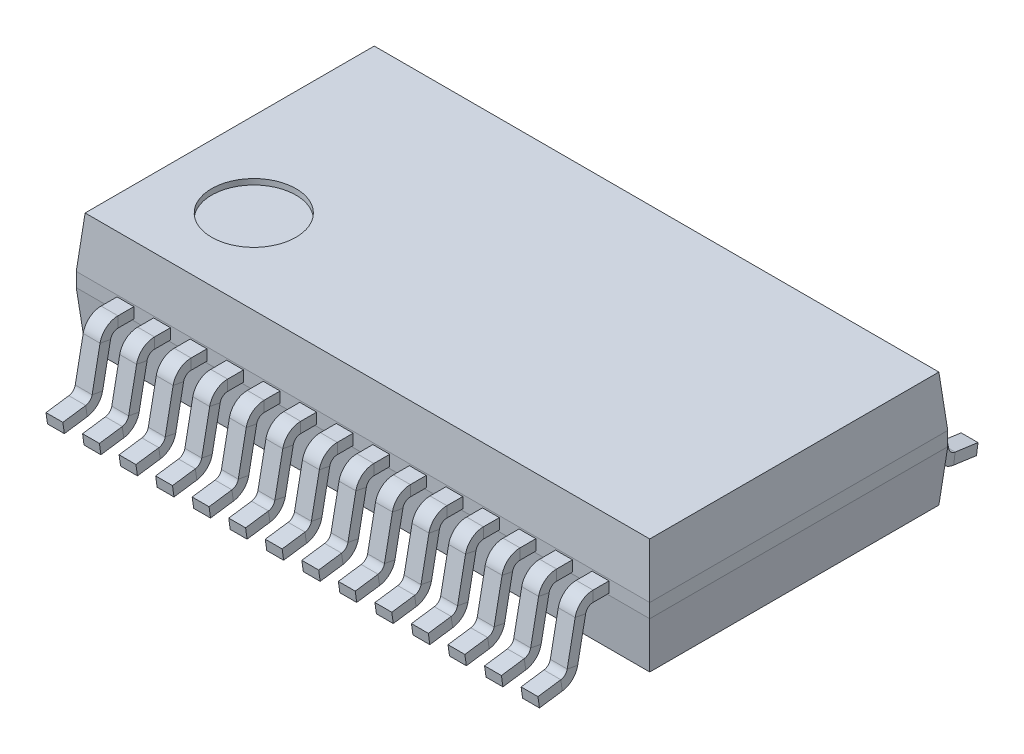
from build123d import *

# Parameters (mm, degrees)
SKETCH1_W                = 10.2
SKETCH1_H                = 5.3
BOSS_EXTRUDE1_DEPTH      = 0.25
SKETCH2_W                = 10.2
SKETCH2_H                = 5.3
BOSS_EXTRUDE2_DEPTH      = 0.9
BOSS_EXTRUDE2_TAPER      = 5
SKETCH3_W                = 10.2
SKETCH3_H                = 5.3
BOSS_EXTRUDE3_DEPTH      = 0.9
BOSS_EXTRUDE3_TAPER      = 5
SKETCH4_W                = 0.3
SKETCH4_H                = 0.19
LPATTERN1_COUNT          = 14
LPATTERN1_PITCH          = 0.65
MIRROR1_COPY_1_SKETCH_W  = 0.3
MIRROR1_COPY_1_SKETCH_H  = 0.19
MIRROR1_COPY_2_SKETCH_W  = 0.3
MIRROR1_COPY_2_SKETCH_H  = 0.19
MIRROR1_COPY_3_SKETCH_W  = 0.3
MIRROR1_COPY_3_SKETCH_H  = 0.19
MIRROR1_COPY_4_SKETCH_W  = 0.3
MIRROR1_COPY_4_SKETCH_H  = 0.19
MIRROR1_COPY_5_SKETCH_W  = 0.3
MIRROR1_COPY_5_SKETCH_H  = 0.19
MIRROR1_COPY_6_SKETCH_W  = 0.3
MIRROR1_COPY_6_SKETCH_H  = 0.19
MIRROR1_COPY_7_SKETCH_W  = 0.3
MIRROR1_COPY_7_SKETCH_H  = 0.19
MIRROR1_COPY_8_SKETCH_W  = 0.3
MIRROR1_COPY_8_SKETCH_H  = 0.19
MIRROR1_COPY_9_SKETCH_W  = 0.3
MIRROR1_COPY_9_SKETCH_H  = 0.19
MIRROR1_COPY_10_SKETCH_W = 0.3
MIRROR1_COPY_10_SKETCH_H = 0.19
MIRROR1_COPY_11_SKETCH_W = 0.3
MIRROR1_COPY_11_SKETCH_H = 0.19
MIRROR1_COPY_12_SKETCH_W = 0.3
MIRROR1_COPY_12_SKETCH_H = 0.19
MIRROR1_COPY_13_SKETCH_W = 0.3
MIRROR1_COPY_13_SKETCH_H = 0.19
SKETCH6_R                = 0.75
CUT_EXTRUDE1_DEPTH       = 0.1


with BuildPart() as part:
    # Sketch1 → Boss-Extrude1 (new body)
    with BuildSketch(Plane(origin=(0, 0, 0), x_dir=(1, 0, 0), z_dir=(0, 1, 0))):
        with Locations((5.1, 2.65)):
            Rectangle(SKETCH1_W, SKETCH1_H)
    extrude(amount=BOSS_EXTRUDE1_DEPTH)

    # Sketch2 → Boss-Extrude2 (add)
    with BuildSketch(Plane(origin=(0, 0.25, 0), x_dir=(1, 0, 0), z_dir=(0, 1, 0))):
        with Locations((5.1, 2.65)):
            Rectangle(SKETCH2_W, SKETCH2_H)
    extrude(amount=BOSS_EXTRUDE2_DEPTH, taper=BOSS_EXTRUDE2_TAPER)

    # Sketch3 → Boss-Extrude3 (add)
    with BuildSketch(Plane.XZ):
        with Locations((5.1, -2.65)):
            Rectangle(SKETCH3_W, SKETCH3_H)
    extrude(amount=BOSS_EXTRUDE3_DEPTH, taper=BOSS_EXTRUDE3_TAPER)

    # Sweep1: sweep along a path in Sketch5
    with BuildLine(Plane(origin=(0, 0, 0), x_dir=(0, 0, -1), z_dir=(1, 0, 0))) as sweep1_path:
        Line((0, 0.125), (-0.282897593, 0.125))
        ThreePointArc((-0.282897593, 0.125), (-0.429105289, 0.072548049), (-0.508627081, -0.060884264))
        Line((-0.508627081, -0.060884264), (-0.65, -0.784255104))
        ThreePointArc((-0.65, -0.784255104), (-0.717492821, -0.907055985), (-0.843719675, -0.967901024))
        Line((-0.843719675, -0.967901024), (-1.25, -1.025))
    # Sketch4 → Sweep1 (sweep)
    with BuildSketch(Plane.XY):
        with Locations((0.875, 0.125)):
            Rectangle(SKETCH4_W, SKETCH4_H)
    sweep1 = sweep(path=sweep1_path.line)

    # LPattern1: Sweep1 ×14
    with Locations(*[(i * LPATTERN1_PITCH, 0, 0) for i in range(1, LPATTERN1_COUNT)]):
        add(sweep1)

    # Mirror1: Sweep1 across plane
    add(sweep1.mirror(Plane.XY.offset(-2.65)))

    # Mirror1 copy 1: sweep along a path in Mirror1 copy 1 path
    with BuildLine(Plane(origin=(0.65, 0, -5.3), x_dir=(0, 0, 1), z_dir=(1, 0, 0))) as mirror1_copy_1_path:
        Line((0, -0.125), (-0.282897593, -0.125))
        ThreePointArc((-0.282897593, -0.125), (-0.429105289, -0.072548049), (-0.508627081, 0.060884264))
        Line((-0.508627081, 0.060884264), (-0.65, 0.784255104))
        ThreePointArc((-0.65, 0.784255104), (-0.717492821, 0.907055985), (-0.843719675, 0.967901024))
        Line((-0.843719675, 0.967901024), (-1.25, 1.025))
    # Mirror1 copy 1 sketch → Mirror1 copy 1 (sweep)
    with BuildSketch(Plane(origin=(0.65, 0, -5.3), x_dir=(1, 0, 0), z_dir=(0, 0, -1))):
        with Locations((0.875, -0.125)):
            Rectangle(MIRROR1_COPY_1_SKETCH_W, MIRROR1_COPY_1_SKETCH_H)
    sweep(path=mirror1_copy_1_path.line)

    # Mirror1 copy 2: sweep along a path in Mirror1 copy 2 path
    with BuildLine(Plane(origin=(1.3, 0, -5.3), x_dir=(0, 0, 1), z_dir=(1, 0, 0))) as mirror1_copy_2_path:
        Line((0, -0.125), (-0.282897593, -0.125))
        ThreePointArc((-0.282897593, -0.125), (-0.429105289, -0.072548049), (-0.508627081, 0.060884264))
        Line((-0.508627081, 0.060884264), (-0.65, 0.784255104))
        ThreePointArc((-0.65, 0.784255104), (-0.717492821, 0.907055985), (-0.843719675, 0.967901024))
        Line((-0.843719675, 0.967901024), (-1.25, 1.025))
    # Mirror1 copy 2 sketch → Mirror1 copy 2 (sweep)
    with BuildSketch(Plane(origin=(1.3, 0, -5.3), x_dir=(1, 0, 0), z_dir=(0, 0, -1))):
        with Locations((0.875, -0.125)):
            Rectangle(MIRROR1_COPY_2_SKETCH_W, MIRROR1_COPY_2_SKETCH_H)
    sweep(path=mirror1_copy_2_path.line)

    # Mirror1 copy 3: sweep along a path in Mirror1 copy 3 path
    with BuildLine(Plane(origin=(1.95, 0, -5.3), x_dir=(0, 0, 1), z_dir=(1, 0, 0))) as mirror1_copy_3_path:
        Line((0, -0.125), (-0.282897593, -0.125))
        ThreePointArc((-0.282897593, -0.125), (-0.429105289, -0.072548049), (-0.508627081, 0.060884264))
        Line((-0.508627081, 0.060884264), (-0.65, 0.784255104))
        ThreePointArc((-0.65, 0.784255104), (-0.717492821, 0.907055985), (-0.843719675, 0.967901024))
        Line((-0.843719675, 0.967901024), (-1.25, 1.025))
    # Mirror1 copy 3 sketch → Mirror1 copy 3 (sweep)
    with BuildSketch(Plane(origin=(1.95, 0, -5.3), x_dir=(1, 0, 0), z_dir=(0, 0, -1))):
        with Locations((0.875, -0.125)):
            Rectangle(MIRROR1_COPY_3_SKETCH_W, MIRROR1_COPY_3_SKETCH_H)
    sweep(path=mirror1_copy_3_path.line)

    # Mirror1 copy 4: sweep along a path in Mirror1 copy 4 path
    with BuildLine(Plane(origin=(2.6, 0, -5.3), x_dir=(0, 0, 1), z_dir=(1, 0, 0))) as mirror1_copy_4_path:
        Line((0, -0.125), (-0.282897593, -0.125))
        ThreePointArc((-0.282897593, -0.125), (-0.429105289, -0.072548049), (-0.508627081, 0.060884264))
        Line((-0.508627081, 0.060884264), (-0.65, 0.784255104))
        ThreePointArc((-0.65, 0.784255104), (-0.717492821, 0.907055985), (-0.843719675, 0.967901024))
        Line((-0.843719675, 0.967901024), (-1.25, 1.025))
    # Mirror1 copy 4 sketch → Mirror1 copy 4 (sweep)
    with BuildSketch(Plane(origin=(2.6, 0, -5.3), x_dir=(1, 0, 0), z_dir=(0, 0, -1))):
        with Locations((0.875, -0.125)):
            Rectangle(MIRROR1_COPY_4_SKETCH_W, MIRROR1_COPY_4_SKETCH_H)
    sweep(path=mirror1_copy_4_path.line)

    # Mirror1 copy 5: sweep along a path in Mirror1 copy 5 path
    with BuildLine(Plane(origin=(3.25, 0, -5.3), x_dir=(0, 0, 1), z_dir=(1, 0, 0))) as mirror1_copy_5_path:
        Line((0, -0.125), (-0.282897593, -0.125))
        ThreePointArc((-0.282897593, -0.125), (-0.429105289, -0.072548049), (-0.508627081, 0.060884264))
        Line((-0.508627081, 0.060884264), (-0.65, 0.784255104))
        ThreePointArc((-0.65, 0.784255104), (-0.717492821, 0.907055985), (-0.843719675, 0.967901024))
        Line((-0.843719675, 0.967901024), (-1.25, 1.025))
    # Mirror1 copy 5 sketch → Mirror1 copy 5 (sweep)
    with BuildSketch(Plane(origin=(3.25, 0, -5.3), x_dir=(1, 0, 0), z_dir=(0, 0, -1))):
        with Locations((0.875, -0.125)):
            Rectangle(MIRROR1_COPY_5_SKETCH_W, MIRROR1_COPY_5_SKETCH_H)
    sweep(path=mirror1_copy_5_path.line)

    # Mirror1 copy 6: sweep along a path in Mirror1 copy 6 path
    with BuildLine(Plane(origin=(3.9, 0, -5.3), x_dir=(0, 0, 1), z_dir=(1, 0, 0))) as mirror1_copy_6_path:
        Line((0, -0.125), (-0.282897593, -0.125))
        ThreePointArc((-0.282897593, -0.125), (-0.429105289, -0.072548049), (-0.508627081, 0.060884264))
        Line((-0.508627081, 0.060884264), (-0.65, 0.784255104))
        ThreePointArc((-0.65, 0.784255104), (-0.717492821, 0.907055985), (-0.843719675, 0.967901024))
        Line((-0.843719675, 0.967901024), (-1.25, 1.025))
    # Mirror1 copy 6 sketch → Mirror1 copy 6 (sweep)
    with BuildSketch(Plane(origin=(3.9, 0, -5.3), x_dir=(1, 0, 0), z_dir=(0, 0, -1))):
        with Locations((0.875, -0.125)):
            Rectangle(MIRROR1_COPY_6_SKETCH_W, MIRROR1_COPY_6_SKETCH_H)
    sweep(path=mirror1_copy_6_path.line)

    # Mirror1 copy 7: sweep along a path in Mirror1 copy 7 path
    with BuildLine(Plane(origin=(4.55, 0, -5.3), x_dir=(0, 0, 1), z_dir=(1, 0, 0))) as mirror1_copy_7_path:
        Line((0, -0.125), (-0.282897593, -0.125))
        ThreePointArc((-0.282897593, -0.125), (-0.429105289, -0.072548049), (-0.508627081, 0.060884264))
        Line((-0.508627081, 0.060884264), (-0.65, 0.784255104))
        ThreePointArc((-0.65, 0.784255104), (-0.717492821, 0.907055985), (-0.843719675, 0.967901024))
        Line((-0.843719675, 0.967901024), (-1.25, 1.025))
    # Mirror1 copy 7 sketch → Mirror1 copy 7 (sweep)
    with BuildSketch(Plane(origin=(4.55, 0, -5.3), x_dir=(1, 0, 0), z_dir=(0, 0, -1))):
        with Locations((0.875, -0.125)):
            Rectangle(MIRROR1_COPY_7_SKETCH_W, MIRROR1_COPY_7_SKETCH_H)
    sweep(path=mirror1_copy_7_path.line)

    # Mirror1 copy 8: sweep along a path in Mirror1 copy 8 path
    with BuildLine(Plane(origin=(5.2, 0, -5.3), x_dir=(0, 0, 1), z_dir=(1, 0, 0))) as mirror1_copy_8_path:
        Line((0, -0.125), (-0.282897593, -0.125))
        ThreePointArc((-0.282897593, -0.125), (-0.429105289, -0.072548049), (-0.508627081, 0.060884264))
        Line((-0.508627081, 0.060884264), (-0.65, 0.784255104))
        ThreePointArc((-0.65, 0.784255104), (-0.717492821, 0.907055985), (-0.843719675, 0.967901024))
        Line((-0.843719675, 0.967901024), (-1.25, 1.025))
    # Mirror1 copy 8 sketch → Mirror1 copy 8 (sweep)
    with BuildSketch(Plane(origin=(5.2, 0, -5.3), x_dir=(1, 0, 0), z_dir=(0, 0, -1))):
        with Locations((0.875, -0.125)):
            Rectangle(MIRROR1_COPY_8_SKETCH_W, MIRROR1_COPY_8_SKETCH_H)
    sweep(path=mirror1_copy_8_path.line)

    # Mirror1 copy 9: sweep along a path in Mirror1 copy 9 path
    with BuildLine(Plane(origin=(5.85, 0, -5.3), x_dir=(0, 0, 1), z_dir=(1, 0, 0))) as mirror1_copy_9_path:
        Line((0, -0.125), (-0.282897593, -0.125))
        ThreePointArc((-0.282897593, -0.125), (-0.429105289, -0.072548049), (-0.508627081, 0.060884264))
        Line((-0.508627081, 0.060884264), (-0.65, 0.784255104))
        ThreePointArc((-0.65, 0.784255104), (-0.717492821, 0.907055985), (-0.843719675, 0.967901024))
        Line((-0.843719675, 0.967901024), (-1.25, 1.025))
    # Mirror1 copy 9 sketch → Mirror1 copy 9 (sweep)
    with BuildSketch(Plane(origin=(5.85, 0, -5.3), x_dir=(1, 0, 0), z_dir=(0, 0, -1))):
        with Locations((0.875, -0.125)):
            Rectangle(MIRROR1_COPY_9_SKETCH_W, MIRROR1_COPY_9_SKETCH_H)
    sweep(path=mirror1_copy_9_path.line)

    # Mirror1 copy 10: sweep along a path in Mirror1 copy 10 path
    with BuildLine(Plane(origin=(6.5, 0, -5.3), x_dir=(0, 0, 1), z_dir=(1, 0, 0))) as mirror1_copy_10_path:
        Line((0, -0.125), (-0.282897593, -0.125))
        ThreePointArc((-0.282897593, -0.125), (-0.429105289, -0.072548049), (-0.508627081, 0.060884264))
        Line((-0.508627081, 0.060884264), (-0.65, 0.784255104))
        ThreePointArc((-0.65, 0.784255104), (-0.717492821, 0.907055985), (-0.843719675, 0.967901024))
        Line((-0.843719675, 0.967901024), (-1.25, 1.025))
    # Mirror1 copy 10 sketch → Mirror1 copy 10 (sweep)
    with BuildSketch(Plane(origin=(6.5, 0, -5.3), x_dir=(1, 0, 0), z_dir=(0, 0, -1))):
        with Locations((0.875, -0.125)):
            Rectangle(MIRROR1_COPY_10_SKETCH_W, MIRROR1_COPY_10_SKETCH_H)
    sweep(path=mirror1_copy_10_path.line)

    # Mirror1 copy 11: sweep along a path in Mirror1 copy 11 path
    with BuildLine(Plane(origin=(7.15, 0, -5.3), x_dir=(0, 0, 1), z_dir=(1, 0, 0))) as mirror1_copy_11_path:
        Line((0, -0.125), (-0.282897593, -0.125))
        ThreePointArc((-0.282897593, -0.125), (-0.429105289, -0.072548049), (-0.508627081, 0.060884264))
        Line((-0.508627081, 0.060884264), (-0.65, 0.784255104))
        ThreePointArc((-0.65, 0.784255104), (-0.717492821, 0.907055985), (-0.843719675, 0.967901024))
        Line((-0.843719675, 0.967901024), (-1.25, 1.025))
    # Mirror1 copy 11 sketch → Mirror1 copy 11 (sweep)
    with BuildSketch(Plane(origin=(7.15, 0, -5.3), x_dir=(1, 0, 0), z_dir=(0, 0, -1))):
        with Locations((0.875, -0.125)):
            Rectangle(MIRROR1_COPY_11_SKETCH_W, MIRROR1_COPY_11_SKETCH_H)
    sweep(path=mirror1_copy_11_path.line)

    # Mirror1 copy 12: sweep along a path in Mirror1 copy 12 path
    with BuildLine(Plane(origin=(7.8, 0, -5.3), x_dir=(0, 0, 1), z_dir=(1, 0, 0))) as mirror1_copy_12_path:
        Line((0, -0.125), (-0.282897593, -0.125))
        ThreePointArc((-0.282897593, -0.125), (-0.429105289, -0.072548049), (-0.508627081, 0.060884264))
        Line((-0.508627081, 0.060884264), (-0.65, 0.784255104))
        ThreePointArc((-0.65, 0.784255104), (-0.717492821, 0.907055985), (-0.843719675, 0.967901024))
        Line((-0.843719675, 0.967901024), (-1.25, 1.025))
    # Mirror1 copy 12 sketch → Mirror1 copy 12 (sweep)
    with BuildSketch(Plane(origin=(7.8, 0, -5.3), x_dir=(1, 0, 0), z_dir=(0, 0, -1))):
        with Locations((0.875, -0.125)):
            Rectangle(MIRROR1_COPY_12_SKETCH_W, MIRROR1_COPY_12_SKETCH_H)
    sweep(path=mirror1_copy_12_path.line)

    # Mirror1 copy 13: sweep along a path in Mirror1 copy 13 path
    with BuildLine(Plane(origin=(8.45, 0, -5.3), x_dir=(0, 0, 1), z_dir=(1, 0, 0))) as mirror1_copy_13_path:
        Line((0, -0.125), (-0.282897593, -0.125))
        ThreePointArc((-0.282897593, -0.125), (-0.429105289, -0.072548049), (-0.508627081, 0.060884264))
        Line((-0.508627081, 0.060884264), (-0.65, 0.784255104))
        ThreePointArc((-0.65, 0.784255104), (-0.717492821, 0.907055985), (-0.843719675, 0.967901024))
        Line((-0.843719675, 0.967901024), (-1.25, 1.025))
    # Mirror1 copy 13 sketch → Mirror1 copy 13 (sweep)
    with BuildSketch(Plane(origin=(8.45, 0, -5.3), x_dir=(1, 0, 0), z_dir=(0, 0, -1))):
        with Locations((0.875, -0.125)):
            Rectangle(MIRROR1_COPY_13_SKETCH_W, MIRROR1_COPY_13_SKETCH_H)
    sweep(path=mirror1_copy_13_path.line)

    # Sketch6 → Cut-Extrude1 (cut)
    with BuildSketch(Plane(origin=(0, 1.15, 0), x_dir=(1, 0, 0), z_dir=(0, 1, 0))):
        with Locations(Location((1.578739797, 1.578739797, 0), (0, 0, 270))):
            Circle(SKETCH6_R)
    extrude(amount=-CUT_EXTRUDE1_DEPTH, mode=Mode.SUBTRACT)


solid = part.part
